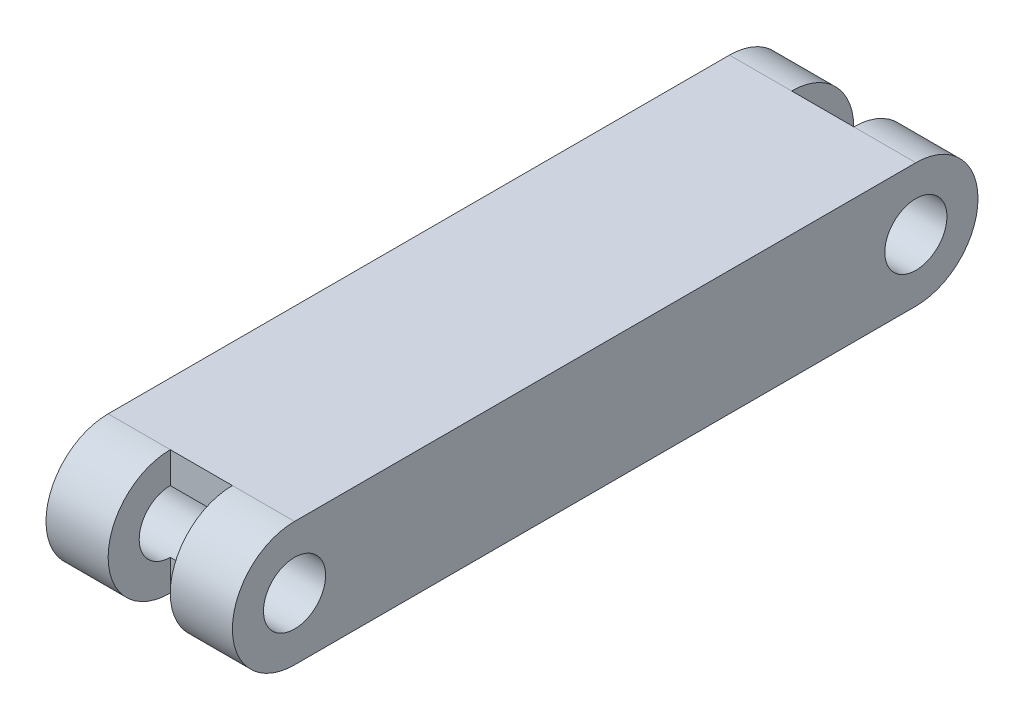
from build123d import *

# Parameters (mm, degrees)
SKETCH_1_W          = 60
SKETCH_1_H          = 40
EXTRUDE_1_DEPTH     = 200
SKETCH_6_R          = 20
EXTRUDE_2_DEPTH     = 20
EXTRUDE_START       = -20
SKETCH_7_R          = 20
EXTRUDE_3_DEPTH     = 20
SKETCH_8_R          = 10
CUT_EXTRUDE_1_DEPTH = 211.297408448
SKETCH_9_R          = 20
CUT_EXTRUDE_2_DEPTH = 20


with BuildPart() as part:
    # 스케치1 → 보스-돌출1 (new body)
    with BuildSketch(Plane.XY):
        with Locations((20, 5)):
            Rectangle(SKETCH_1_W, SKETCH_1_H)
    extrude(amount=EXTRUDE_1_DEPTH)

    # 스케치6 → 보스-돌출2 (add)
    with BuildSketch(Plane(origin=(50, 0, 0), x_dir=(0, 0, -1), z_dir=(1, 0, 0))):
        with Locations((0, 5)):
            Circle(SKETCH_6_R)
    extrude_2 = extrude(amount=-EXTRUDE_2_DEPTH)

    # 스케치7 → 보스-돌출3 (add)
    with BuildSketch(Plane.ZY.offset(10).offset(EXTRUDE_START)):
        with Locations((0, 5)):
            Circle(SKETCH_7_R)
    extrude_3 = extrude(amount=EXTRUDE_3_DEPTH)

    # 스케치8 → 컷-돌출1 (cut, symmetric)
    with BuildSketch(Plane.ZY.offset(10)):
        with Locations((0, 5)):
            Circle(SKETCH_8_R)
    cut_extrude_1 = extrude(amount=CUT_EXTRUDE_1_DEPTH, both=True, mode=Mode.SUBTRACT)

    # 대칭 복사1: 보스-돌출2, 보스-돌출3, 컷-돌출1 across plane
    add(extrude_2.mirror(Plane.XY.offset(100)))
    add(extrude_3.mirror(Plane.XY.offset(100)))
    add(cut_extrude_1.mirror(Plane.XY.offset(100)), mode=Mode.SUBTRACT)

    # 스케치9 → 컷-돌출2 (cut)
    with BuildSketch(Plane.ZY.offset(-30)):
        with Locations((0, 5)):
            Circle(SKETCH_9_R)
    extrude(amount=CUT_EXTRUDE_2_DEPTH, mode=Mode.SUBTRACT)


solid = part.part
